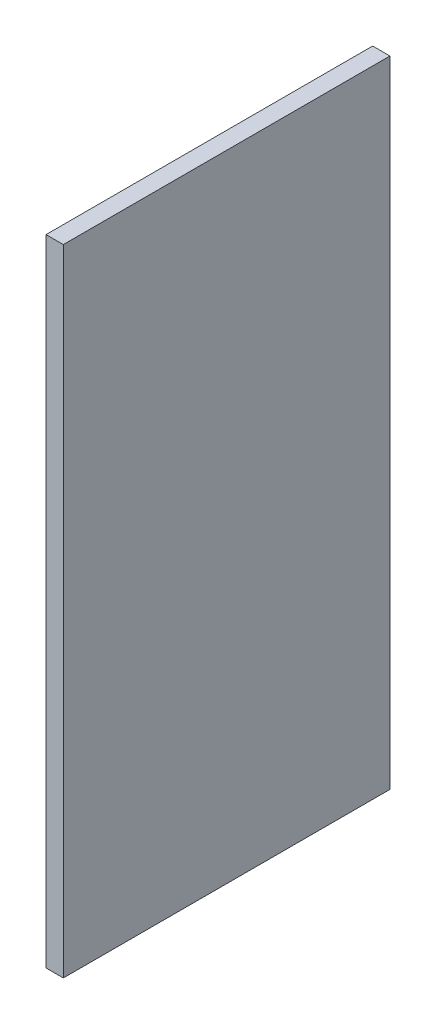
from build123d import *

# Parameters (mm, degrees)
CROQUIS2_W              = 180
CROQUIS2_H              = 350
SALIENTE_EXTRUIR1_DEPTH = 4.7625


with BuildPart() as part:
    # Croquis2 → Saliente-Extruir1 (new, symmetric)
    with BuildSketch(Plane(origin=(0, 0, 0), x_dir=(0, 0, -1), z_dir=(1, 0, 0))):
        Rectangle(CROQUIS2_W, CROQUIS2_H)
    extrude(amount=SALIENTE_EXTRUIR1_DEPTH, both=True)


solid = part.part
